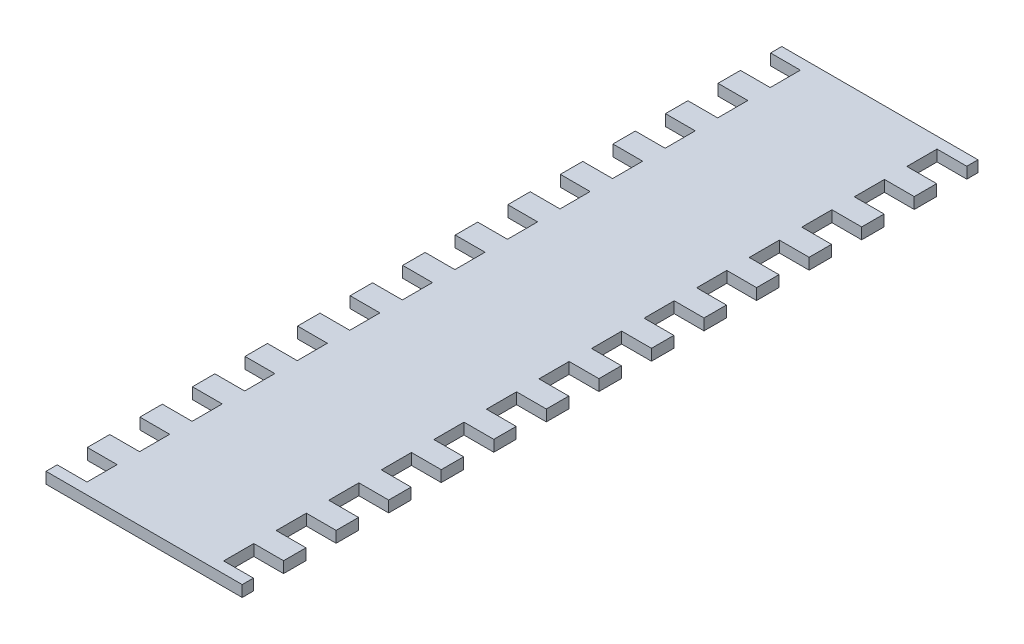
from build123d import *

# Parameters (mm, degrees)
BOSS_EXTRUDE1_DEPTH     = 1.6
CUT_EXTRUDE1_DEPTH      = 108.527298859
CUT_EXTRUDE1_DEPTH_BACK = 108.527298859
SKETCH2_OUTSIDE_W       = 52.356
SKETCH2_OUTSIDE_H       = 132.556
SKETCH2_OUTSIDE_W_2     = 49.825582729
SKETCH2_OUTSIDE_H_2     = 105


with BuildPart() as part:
    # Sketch1 → Boss-Extrude1 (new body)
    with BuildSketch(Plane(origin=(0, 0, 0), x_dir=(1, 0, 0), z_dir=(0, 1, 0))):
        Polygon((14, -1.6), (-14, -1.6), (-14, 1.6), (-9.75, 1.6), (-9.75, 5.9), (-14, 5.9), (-14, 9.1), (-9.75, 9.1), (-9.75, 13.4), (-14, 13.4), (-14, 16.6), (-9.75, 16.6), (-9.75, 20.9), (-14, 20.9), (-14, 24.1), (-9.75, 24.1), (-9.75, 28.4), (-14, 28.4), (-14, 31.6), (-9.75, 31.6), (-9.75, 35.9), (-14, 35.9), (-14, 39.1), (-9.75, 39.1), (-9.75, 43.4), (-14, 43.4), (-14, 46.6), (-9.75, 46.6), (-9.75, 50.9), (-14, 50.9), (-14, 54.1), (-9.75, 54.1), (-9.75, 58.4), (-14, 58.4), (-14, 61.6), (-9.75, 61.6), (-9.75, 65.9), (-14, 65.9), (-14, 69.1), (-9.75, 69.1), (-9.75, 73.4), (-14, 73.4), (-14, 76.6), (-9.75, 76.6), (-9.75, 80.9), (-14, 80.9), (-14, 84.1), (-9.75, 84.1), (-9.75, 88.4), (-14, 88.4), (-14, 91.6), (-9.75, 91.6), (-9.75, 95.9), (-14, 95.9), (-14, 99.1), (-9.75, 99.1), (-9.75, 103.4), (-14, 103.4), (-14, 106.6), (14, 106.6), (14, 103.4), (9.75, 103.4), (9.75, 99.1), (14, 99.1), (14, 95.9), (9.75, 95.9), (9.75, 91.6), (14, 91.6), (14, 88.4), (9.75, 88.4), (9.75, 84.1), (14, 84.1), (14, 80.9), (9.75, 80.9), (9.75, 76.6), (14, 76.6), (14, 73.4), (9.75, 73.4), (9.75, 69.1), (14, 69.1), (14, 65.9), (9.75, 65.9), (9.75, 61.6), (14, 61.6), (14, 58.4), (9.75, 58.4), (9.75, 54.1), (14, 54.1), (14, 50.9), (9.75, 50.9), (9.75, 46.6), (14, 46.6), (14, 43.4), (9.75, 43.4), (9.75, 39.1), (14, 39.1), (14, 35.9), (9.75, 35.9), (9.75, 31.6), (14, 31.6), (14, 28.4), (9.75, 28.4), (9.75, 24.1), (14, 24.1), (14, 20.9), (9.75, 20.9), (9.75, 16.6), (14, 16.6), (14, 13.4), (9.75, 13.4), (9.75, 9.1), (14, 9.1), (14, 5.9), (9.75, 5.9), (9.75, 1.6), (14, 1.6), align=None)
    extrude(amount=BOSS_EXTRUDE1_DEPTH)

    # Sketch2 outside → Cut-Extrude1 (cut, two sides: drawn at the far end of the back side and taken through both)
    with BuildSketch(Plane(origin=(0, 1.6, 0), x_dir=(1, 0, 0), z_dir=(0, 1, 0)).offset(-CUT_EXTRUDE1_DEPTH_BACK)):
        with Locations((0, 52.5)):
            Rectangle(SKETCH2_OUTSIDE_W, SKETCH2_OUTSIDE_H)
        with Locations((0.983399659, 52.5)):
            Rectangle(SKETCH2_OUTSIDE_W_2, SKETCH2_OUTSIDE_H_2, mode=Mode.SUBTRACT)
    extrude(amount=CUT_EXTRUDE1_DEPTH + CUT_EXTRUDE1_DEPTH_BACK, mode=Mode.SUBTRACT)


solid = part.part
